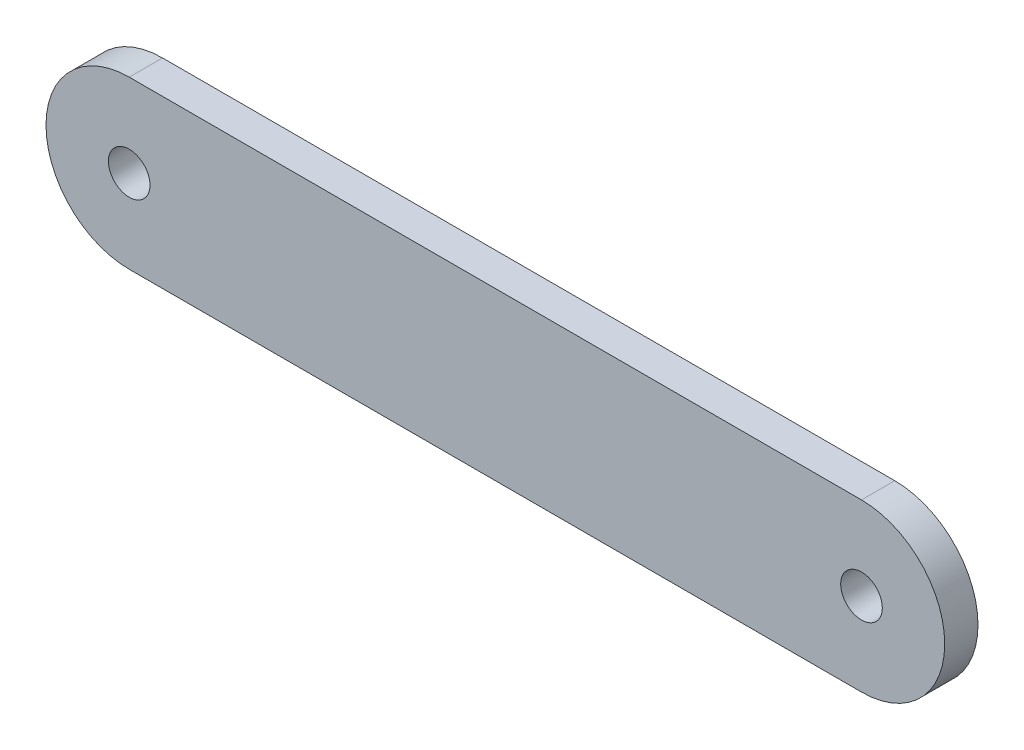
from build123d import *

# Parameters (mm, degrees)
SKETCH2_R           = 1.25
BOSS_EXTRUDE1_DEPTH = 2


with BuildPart() as part:
    # Sketch2 → Boss-Extrude1 (new body)
    with BuildSketch(Plane.XY):
        with BuildLine():
            Line((0, 5), (44, 5))
            ThreePointArc((44, 5), (49, 0), (44, -5))
            Line((44, -5), (0, -5))
            ThreePointArc((0, -5), (-5, 0), (0, 5))
        make_face()
        Circle(SKETCH2_R, mode=Mode.SUBTRACT)
        with Locations((44, 0)):
            Circle(SKETCH2_R, mode=Mode.SUBTRACT)
    extrude(amount=BOSS_EXTRUDE1_DEPTH)


solid = part.part
